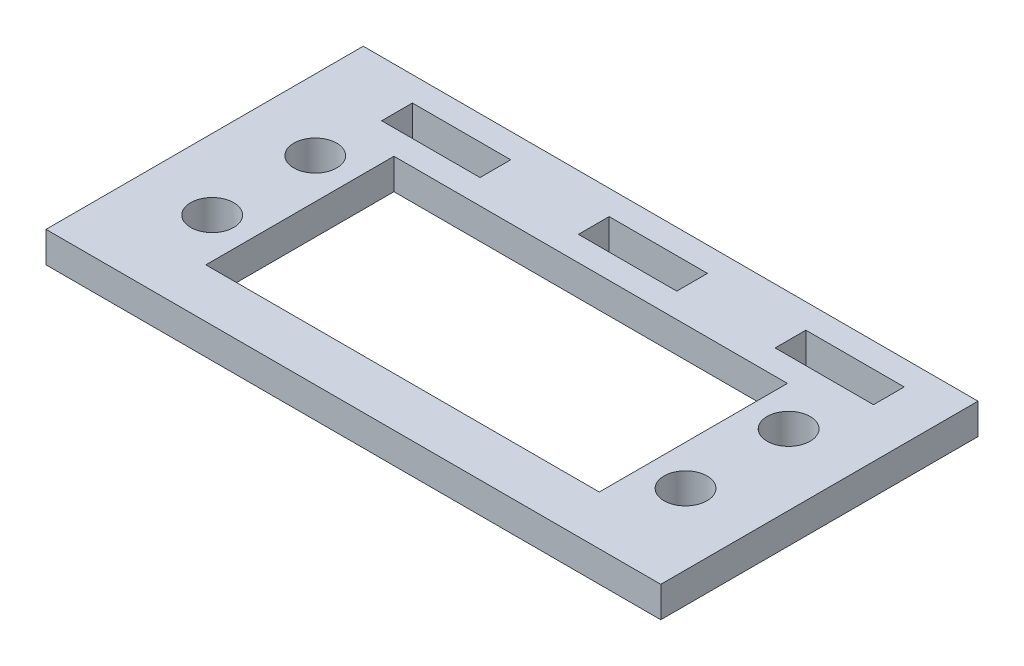
from build123d import *

# Parameters (mm, degrees)
SKETCH1_W           = 63.5
SKETCH1_H           = 32.766
SKETCH1_R           = 2.2225
SKETCH1_W_2         = 10.16
SKETCH1_H_2         = 3.175
SKETCH1_W_3         = 40.64
SKETCH1_H_3         = 19.431
BOSS_EXTRUDE2_DEPTH = 3.175


with BuildPart() as part:
    # Sketch1 → Boss-Extrude2 (new body)
    with BuildSketch(Plane(origin=(0, 0, 0), x_dir=(1, 0, 0), z_dir=(0, 1, 0))):
        with Locations((0, 1.5875)):
            Rectangle(SKETCH1_W, SKETCH1_H)
        with Locations(Location((-24.4475, 5.711910092, 0), (0, 0, 270))):
            Circle(SKETCH1_R, mode=Mode.SUBTRACT)
        with Locations(Location((-24.4475, -4.93498923, 0), (0, 0, 270))):
            Circle(SKETCH1_R, mode=Mode.SUBTRACT)
        with Locations(Location((24.4475, 5.711910092, 0), (0, 0, 270))):
            Circle(SKETCH1_R, mode=Mode.SUBTRACT)
        with Locations(Location((24.4475, -4.93498923, 0), (0, 0, 270))):
            Circle(SKETCH1_R, mode=Mode.SUBTRACT)
        with Locations((21.59, 13.843)):
            Rectangle(SKETCH1_W_2, SKETCH1_H_2, mode=Mode.SUBTRACT)
        with Locations((1.27, 13.843)):
            Rectangle(SKETCH1_W_2, SKETCH1_H_2, mode=Mode.SUBTRACT)
        with Locations((-19.05, 13.843)):
            Rectangle(SKETCH1_W_2, SKETCH1_H_2, mode=Mode.SUBTRACT)
        Rectangle(SKETCH1_W_3, SKETCH1_H_3, mode=Mode.SUBTRACT)
    extrude(amount=BOSS_EXTRUDE2_DEPTH)


solid = part.part
